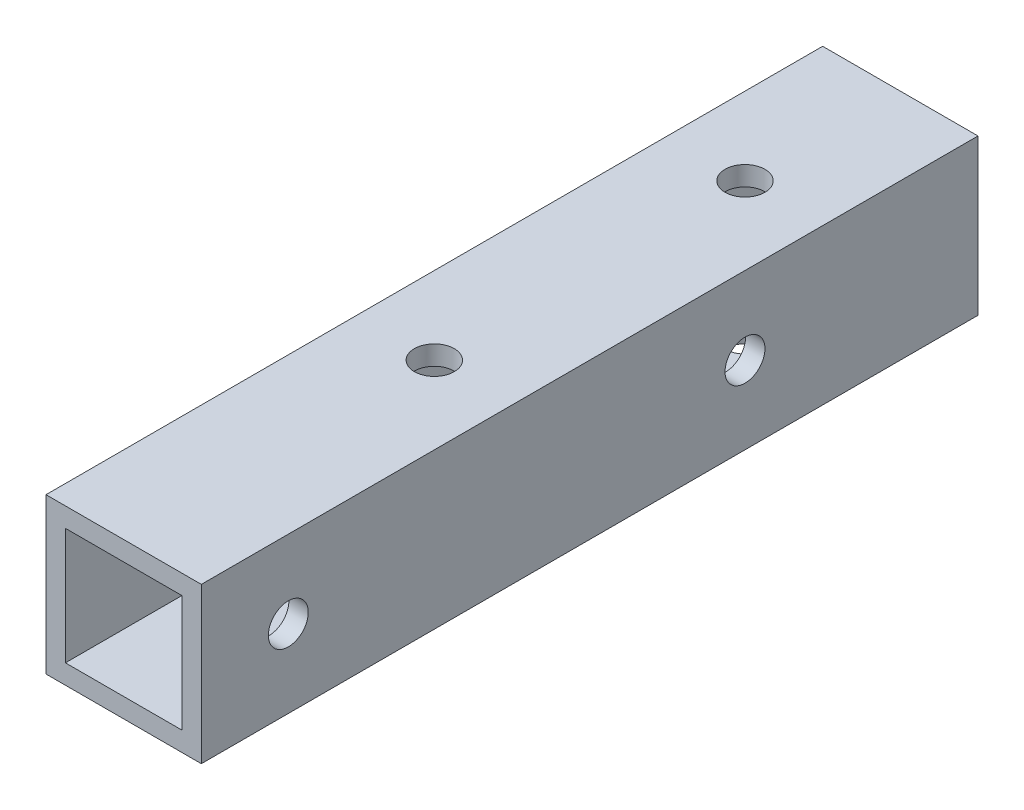
from build123d import *

# Parameters (mm, degrees)
SKETCH2_W           = 25.4
SKETCH2_H           = 25.4
BOSS_EXTRUDE1_DEPTH = 127
SKETCH4_W           = 19.05
SKETCH4_H           = 19.05
CUT_EXTRUDE1_DEPTH  = 129.263712717
SKETCH5_R           = 3.2639
CUT_EXTRUDE2_DEPTH  = 304.8
SKETCH6_R           = 3.2639
CUT_EXTRUDE3_DEPTH  = 131.136274728
SKETCH7_R           = 3.2639
CUT_EXTRUDE4_DEPTH  = 131.136274728


with BuildPart() as part:
    # Sketch2 → Boss-Extrude1 (new body)
    with BuildSketch(Plane.XY):
        Rectangle(SKETCH2_W, SKETCH2_H)
    extrude(amount=BOSS_EXTRUDE1_DEPTH)

    # Sketch4 → Cut-Extrude1 (cut, through all)
    with BuildSketch(Plane.XY):
        Rectangle(SKETCH4_W, SKETCH4_H)
    extrude(amount=CUT_EXTRUDE1_DEPTH, mode=Mode.SUBTRACT)

    # Sketch5 → Cut-Extrude2 (cut)
    with BuildSketch(Plane(origin=(0, 12.7, 0), x_dir=(1, 0, 0), z_dir=(0, 1, 0))):
        with Locations(Location((0, -25.4, 0), (0, 0, 270))):
            Circle(SKETCH5_R)
    extrude(amount=-CUT_EXTRUDE2_DEPTH, mode=Mode.SUBTRACT)

    # Sketch6 → Cut-Extrude3 (cut, through all)
    with BuildSketch(Plane(origin=(0, 12.7, 0), x_dir=(1, 0, 0), z_dir=(0, 1, 0))):
        with Locations(Location((0, -76.2, 0), (0, 0, 270))):
            Circle(SKETCH6_R)
    extrude(amount=-CUT_EXTRUDE3_DEPTH, mode=Mode.SUBTRACT)

    # Sketch7 → Cut-Extrude4 (cut, through all)
    with BuildSketch(Plane.ZY.offset(12.7)):
        with Locations((38.1, 0)):
            Circle(SKETCH7_R)
        with Locations((112.776, 0)):
            Circle(SKETCH7_R)
    extrude(amount=-CUT_EXTRUDE4_DEPTH, mode=Mode.SUBTRACT)


solid = part.part
